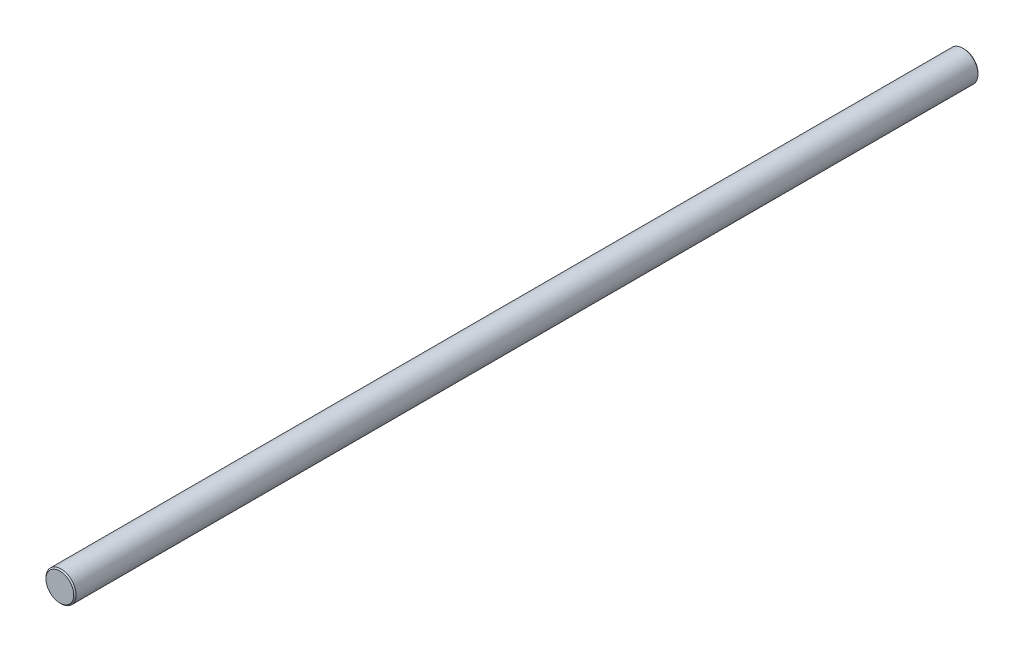
from build123d import *

# Parameters (mm, degrees)
SKETCH_1_R      = 12.5
EXTRUDE_1_DEPTH = 375
CHAMFER_1_SIZE  = 1


with BuildPart() as part:
    # Эскиз1 → Бобышка-Вытянуть1 (new, symmetric)
    with BuildSketch(Plane.XY):
        Circle(SKETCH_1_R)
    extrude(amount=EXTRUDE_1_DEPTH, both=True)

    # Фаска1
    chamfer_1_edges = [part.edges().sort_by_distance(p)[0] for p in [
        (-12.5, 0, -375),
        (-12.5, 0, 375),
    ]]
    chamfer(chamfer_1_edges, length=CHAMFER_1_SIZE)


solid = part.part
